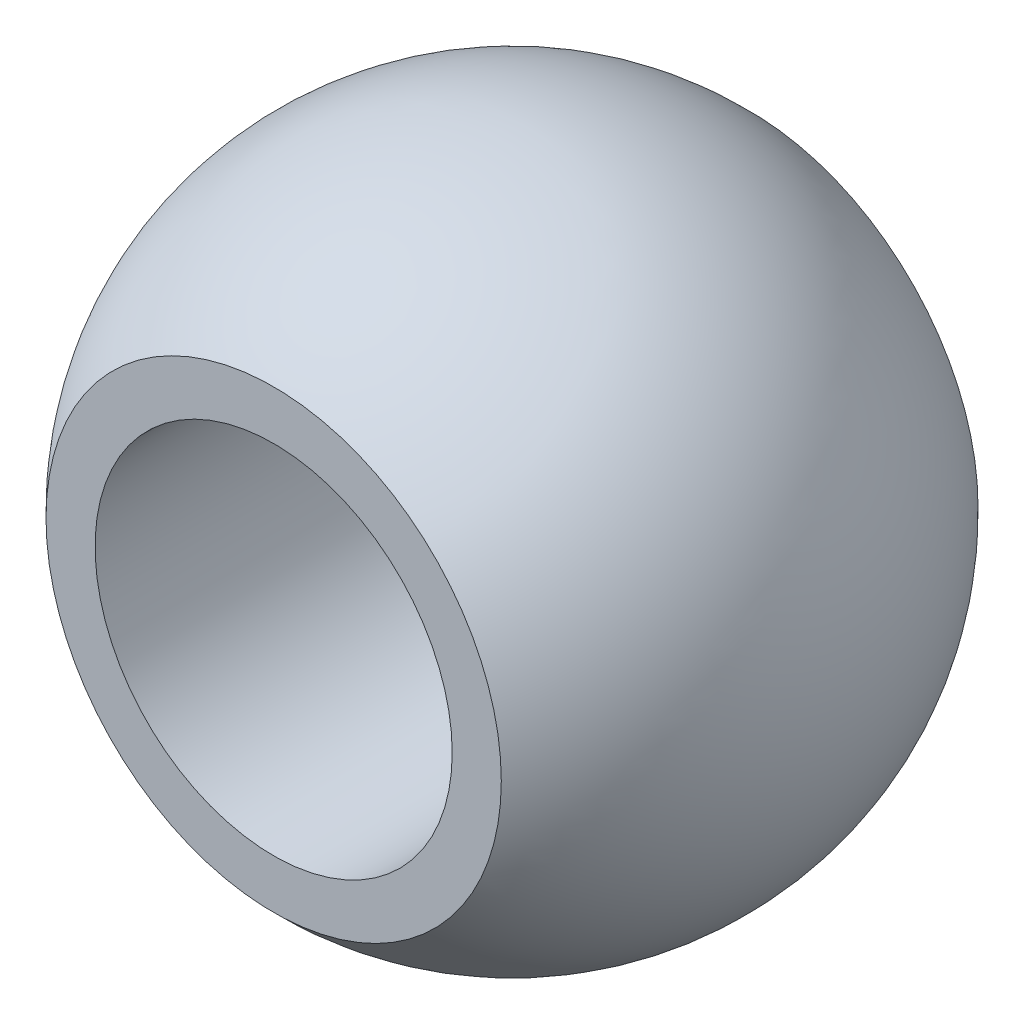
from build123d import *

# Parameters (mm, degrees)
SKETCH_2_R          = 6
CUT_EXTRUDE_1_DEPTH = 75


with BuildPart() as part:
    # 스케치1 → 회전1 (revolve)
    with BuildSketch(Plane.XY):
        with BuildLine():
            Line((0, 11.075), (0, -11.075))
            ThreePointArc((0, -11.075), (11.075, 0), (0, 11.075))
        make_face()
    revolve(axis=Axis((0, 11.075, 0), (0, -1, 0)))

    # 스케치2 → 컷-돌출1 (cut, symmetric)
    with BuildSketch(Plane.XY):
        with Locations(Location((0, 0, 0), (0, 0, 180))):
            Circle(SKETCH_2_R)
    extrude(amount=CUT_EXTRUDE_1_DEPTH, both=True, mode=Mode.SUBTRACT)

    # 스케치3 → 컷-회전4 (revolve, cut)
    with BuildSketch(Plane(origin=(0, 0, 0), x_dir=(1, 0, 0), z_dir=(0, 1, 0)), mode=Mode.PRIVATE) as cut_revolve_4_sk:
        Polygon((0, -9.308900311), (0, -8.008900311), (-12.865468555, -8.008900311), (-12.865468555, -13.804148022), (0, -13.804148022), align=None)
    revolve(cut_revolve_4_sk.sketch.rotate(Axis((0, 0, 13.804148022), (0, 0, -1)), 180), axis=Axis((0, 0, 13.804148022), (0, 0, -1)), mode=Mode.SUBTRACT)

    # 스케치5 → 컷-회전5 (revolve, cut)
    with BuildSketch(Plane(origin=(0, 0, 0), x_dir=(1, 0, 0), z_dir=(0, 1, 0)), mode=Mode.PRIVATE) as cut_revolve_5_sk:
        Polygon((0, 9.308900311), (0, 8.008900311), (-11.242907582, 8.008900311), (-11.242907582, 14.018759503), (0, 14.018759503), align=None)
    revolve(cut_revolve_5_sk.sketch.rotate(Axis((0, 0, -14.018759503), (0, 0, 1)), 180), axis=Axis((0, 0, -14.018759503), (0, 0, 1)), mode=Mode.SUBTRACT)


solid = part.part
